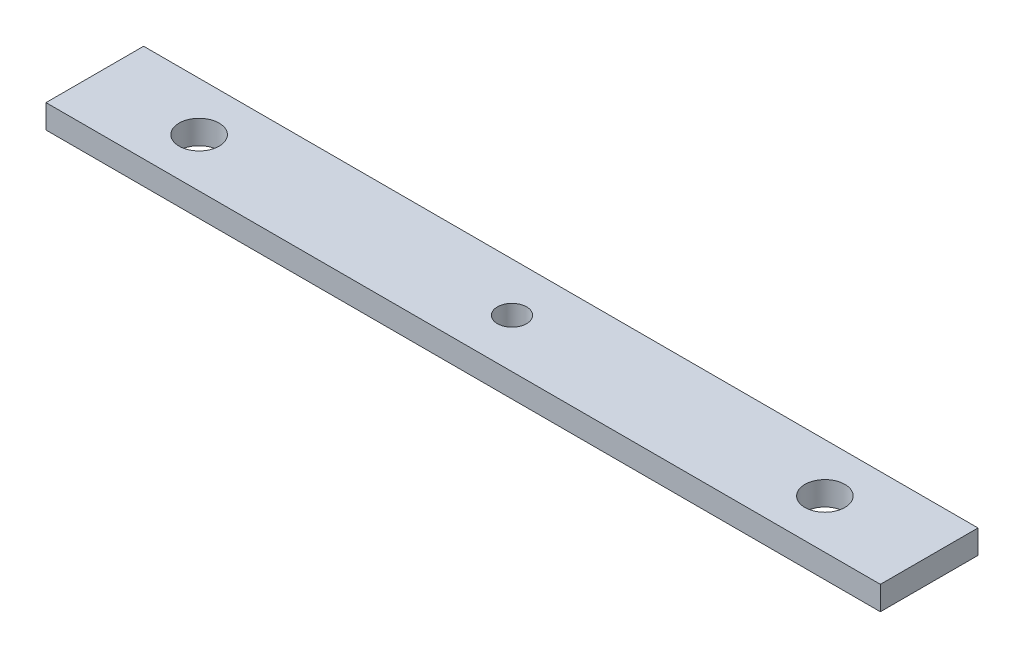
from build123d import *

# Parameters (mm, degrees)
SKETCH1_W           = 100
SKETCH1_H           = 11.7
BOSS_EXTRUDE1_DEPTH = 2.85
SKETCH2_R           = 1.75
CUT_EXTRUDE3_DEPTH  = 51.421671928
SKETCH3_R           = 2.4
CUT_EXTRUDE4_DEPTH  = 51.662732852


with BuildPart() as part:
    # Sketch1 → Boss-Extrude1 (new body)
    with BuildSketch(Plane(origin=(0, 0, 0), x_dir=(1, 0, 0), z_dir=(0, 1, 0))):
        Rectangle(SKETCH1_W, SKETCH1_H)
    extrude(amount=BOSS_EXTRUDE1_DEPTH)

    # Sketch2 → Cut-Extrude3 (cut, through all)
    with BuildSketch(Plane(origin=(0, 2.85, 0), x_dir=(1, 0, 0), z_dir=(0, 1, 0))):
        with Locations(Location((0, 0, 0), (0, 0, 270))):
            Circle(SKETCH2_R)
    extrude(amount=-CUT_EXTRUDE3_DEPTH, mode=Mode.SUBTRACT)

    # Sketch3 → Cut-Extrude4 (cut, through all)
    with BuildSketch(Plane.XZ.offset(2.85)):
        with Locations(Location((-37.5, 0, 0), (0, 0, 270))):
            Circle(SKETCH3_R)
        with Locations(Location((37.5, 0, 0), (0, 0, 270))):
            Circle(SKETCH3_R)
    extrude(amount=-CUT_EXTRUDE4_DEPTH, mode=Mode.SUBTRACT)


solid = part.part
